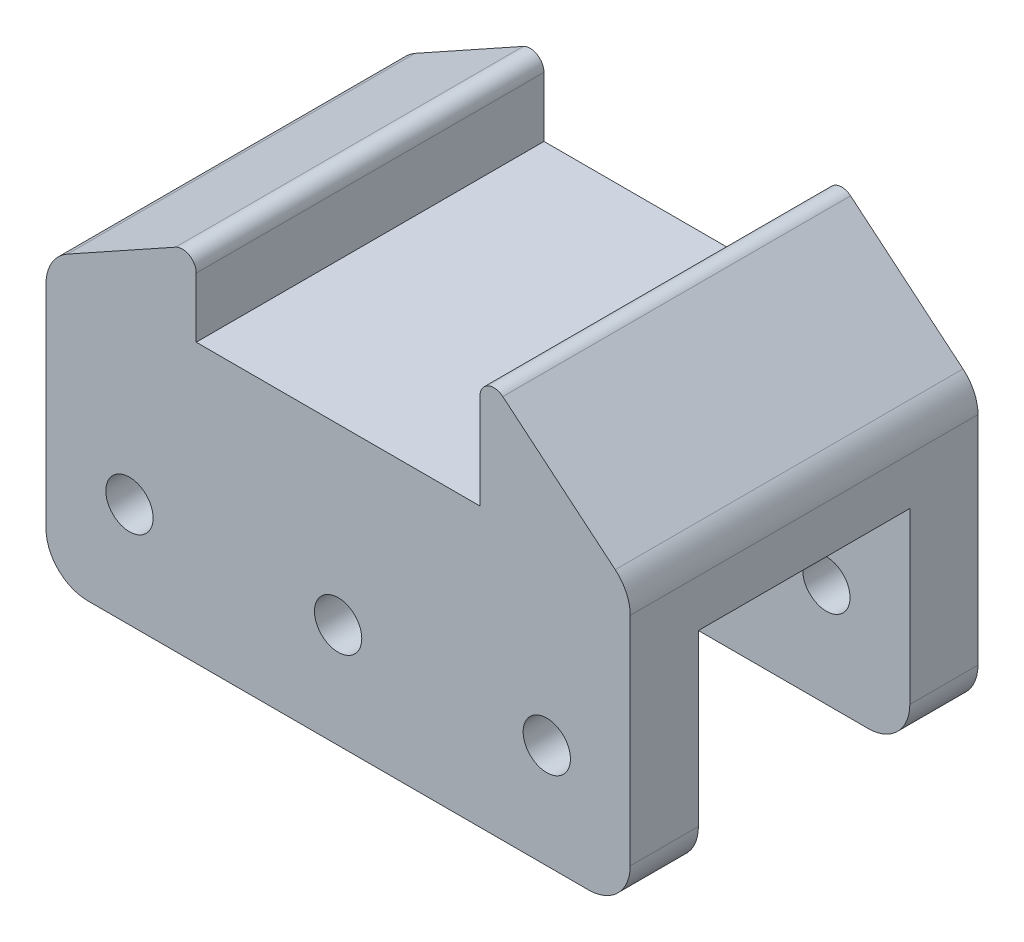
from build123d import *

# Parameters (mm, degrees)
SKETCH_1_W          = 42
SKETCH_1_H          = 25
EXTRUDE_1_DEPTH     = 20
SKETCH_2_W          = 15.2
SKETCH_2_H          = 15.2
CUT_EXTRUDE_1_DEPTH = 53.810983706
EXTRUDE_2_DEPTH     = 25
SKETCH_5_R          = 1.7
CUT_EXTRUDE_2_DEPTH = 57.833088954
FILLET_1_R          = 3
FILLET_3_R          = 1


with BuildPart() as part:
    # 草图1 → 凸台-拉伸1 (new body)
    with BuildSketch(Plane(origin=(0, 0, 0), x_dir=(1, 0, 0), z_dir=(0, 1, 0))):
        with Locations((21, 12.5)):
            Rectangle(SKETCH_1_W, SKETCH_1_H)
    extrude(amount=EXTRUDE_1_DEPTH)

    # 草图2 → 切除-拉伸1 (cut, through all)
    with BuildSketch(Plane.ZY):
        with Locations((-12.5, 7.6)):
            Rectangle(SKETCH_2_W, SKETCH_2_H)
    extrude(amount=-CUT_EXTRUDE_1_DEPTH, mode=Mode.SUBTRACT)

    # 草图4 → 凸台-拉伸2 (add)
    with BuildSketch(Plane.XY):
        Polygon((10.8, 26), (10.8, 20), (0, 20), align=None)
        Polygon((31.2, 20), (31.2, 29), (42, 20), align=None)
    extrude(amount=-EXTRUDE_2_DEPTH)

    # 草图5 → 切除-拉伸2 (cut, through all)
    with BuildSketch(Plane.XY):
        with Locations((6, 7.5)):
            Circle(SKETCH_5_R)
        with Locations((21, 7.5)):
            Circle(SKETCH_5_R)
        with Locations((36, 7.5)):
            Circle(SKETCH_5_R)
    extrude(amount=-CUT_EXTRUDE_2_DEPTH, mode=Mode.SUBTRACT)

    # 圆角1
    fillet_1_edges = [part.edges().sort_by_distance(p)[0] for p in [
        (42, 20, -12.5),
        (0, 0, -2.45),
        (42, 0, -22.55),
        (0, 20, -12.5),
        (42, 0, -2.45),
        (0, 0, -22.55),
    ]]
    fillet(fillet_1_edges, radius=FILLET_1_R)

    # 圆角3
    fillet_3_edges = [part.edges().sort_by_distance(p)[0] for p in [
        (10.8, 26, -12.5),
        (31.2, 29, -12.5),
    ]]
    fillet(fillet_3_edges, radius=FILLET_3_R)


solid = part.part
